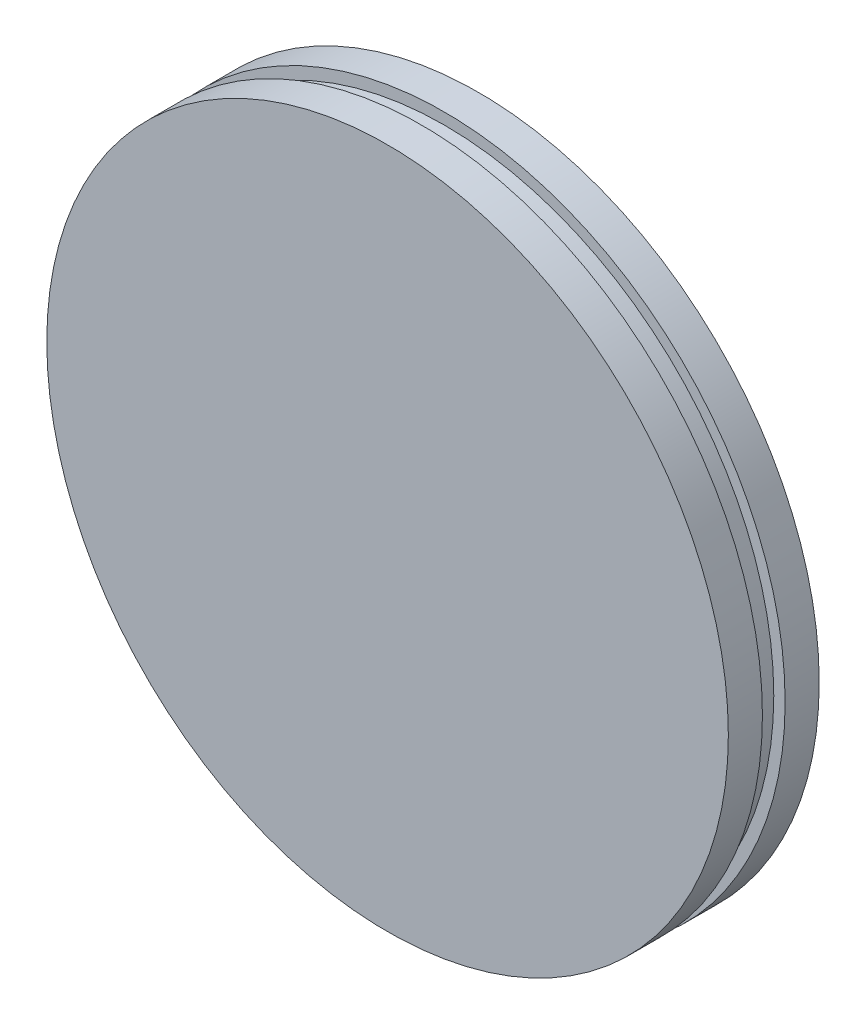
from build123d import *

# Parameters (mm, degrees)
ESQUISSE1_R                  = 30
ESQUISSE1_R_2                = 11
BOSS_EXTRU_1_DEPTH           = 6
ESQUISSE2_R                  = 30
BOSS_EXTRU_2_DEPTH           = 2
ENL_V_MAT_EXTRU_1_DEPTH      = 1
ENL_V_MAT_EXTRU_1_DEPTH_BACK = 1
ESQUISSE3_R                  = 30
ESQUISSE3_R_2                = 29


with BuildPart() as part:
    # Esquisse1 → Boss.-Extru.1 (new body)
    with BuildSketch(Plane.XY):
        Circle(ESQUISSE1_R)
        Circle(ESQUISSE1_R_2, mode=Mode.SUBTRACT)
    extrude(amount=BOSS_EXTRU_1_DEPTH)

    # Esquisse2 → Boss.-Extru.2 (add)
    with BuildSketch(Plane.XY.offset(6)):
        Circle(ESQUISSE2_R)
    extrude(amount=BOSS_EXTRU_2_DEPTH)

    # Esquisse3 → Enlèv. mat.-Extru.1 (cut, two sides: drawn at the far end of the back side and taken through both)
    with BuildSketch(Plane.XY.offset(4).offset(-ENL_V_MAT_EXTRU_1_DEPTH_BACK)):
        Circle(ESQUISSE3_R)
        Circle(ESQUISSE3_R_2, mode=Mode.SUBTRACT)
    extrude(amount=ENL_V_MAT_EXTRU_1_DEPTH + ENL_V_MAT_EXTRU_1_DEPTH_BACK, mode=Mode.SUBTRACT)


solid = part.part
